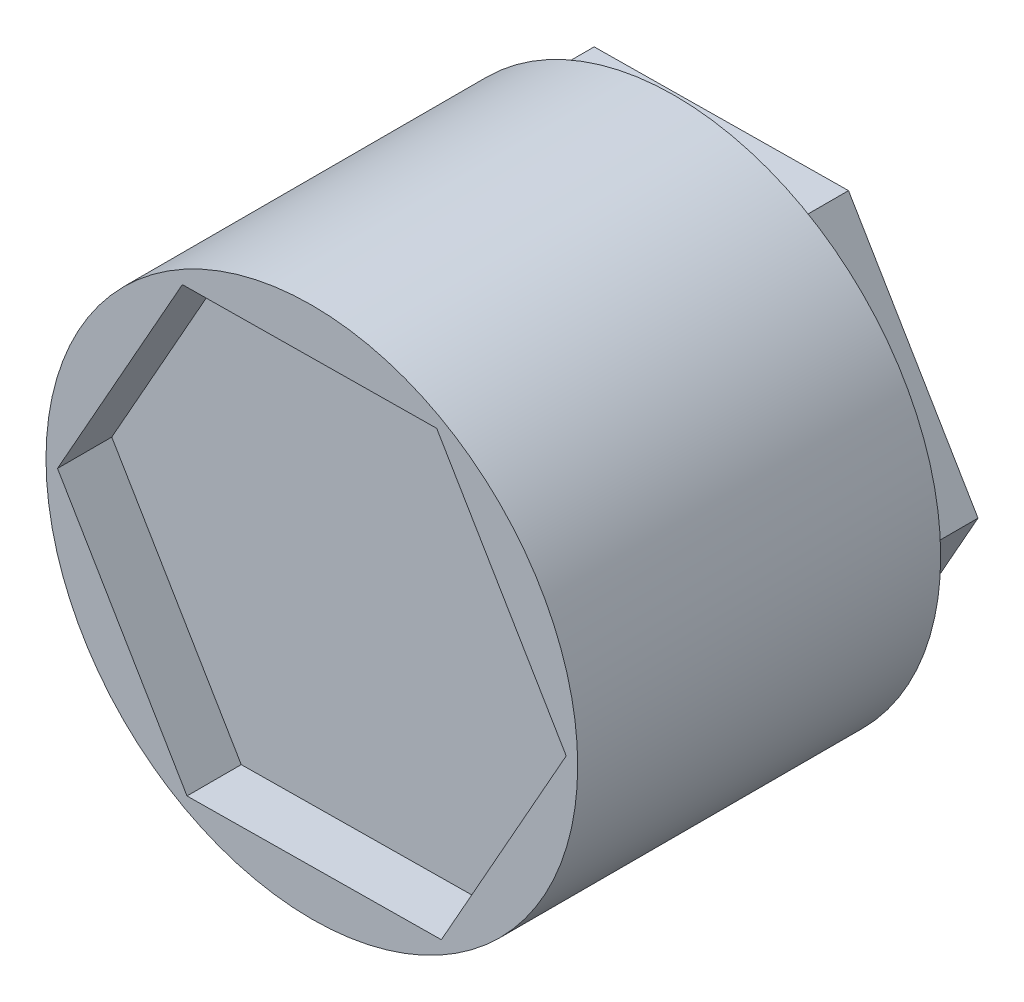
from build123d import *

# Parameters (mm, degrees)
BOSS_EXTRUDE1_DEPTH = 4.5
SKETCH3_R           = 24.5
BOSS_EXTRUDE2_DEPTH = 33.45
CUT_EXTRUDE1_DEPTH  = 5


with BuildPart() as part:
    # Sketch1 → Boss-Extrude1 (new body)
    with BuildSketch(Plane(origin=(0, 0, 0), x_dir=(0, 1, 0), z_dir=(0, 0, 1))):
        Polygon((20.175580242, 11.933117582), (-0.246592851, 23.439123817), (-20.422173094, 11.506006235), (-20.175580242, -11.933117582), (0.246592851, -23.439123817), (20.422173094, -11.506006235), align=None)
    extrude(amount=BOSS_EXTRUDE1_DEPTH)

    # Sketch3 → Boss-Extrude2 (add)
    with BuildSketch(Plane.XY.offset(4.5)):
        Circle(SKETCH3_R)
    extrude(amount=BOSS_EXTRUDE2_DEPTH)

    # Sketch4 → Cut-Extrude1 (cut)
    with BuildSketch(Plane.XY.offset(37.95)):
        Polygon((11.506006235, 20.422173094), (-11.933117582, 20.175580242), (-23.439123817, -0.246592851), (-11.506006235, -20.422173094), (11.933117582, -20.175580242), (23.439123817, 0.246592851), align=None)
    extrude(amount=-CUT_EXTRUDE1_DEPTH, mode=Mode.SUBTRACT)


solid = part.part
